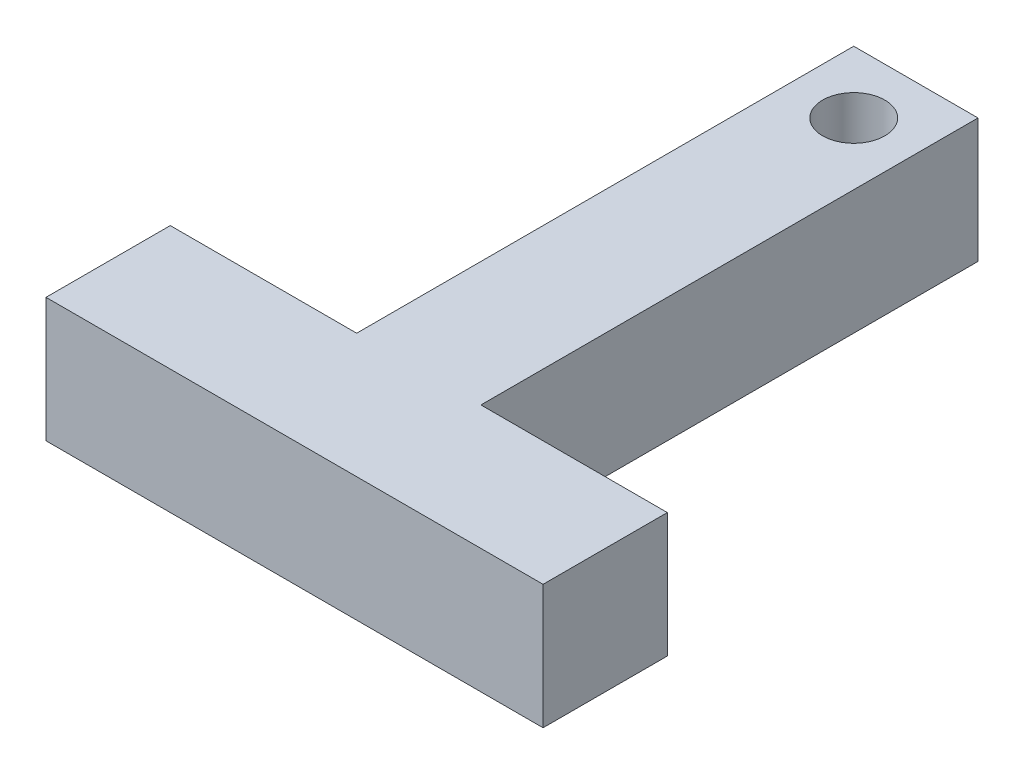
from build123d import *

# Parameters (mm, degrees)
EXTRUDE_1_DEPTH     = 1
SKETCH_2_R          = 0.25
CUT_EXTRUDE_1_DEPTH = 40.833518874


with BuildPart() as part:
    # 草图1 → 凸台-拉伸1 (new body)
    with BuildSketch(Plane(origin=(0, 0, 0), x_dir=(1, 0, 0), z_dir=(0, 1, 0))):
        Polygon((-2, 35.770708139), (-0.5, 35.770708139), (-0.5, 39.770708139), (0.5, 39.770708139), (0.5, 35.770708139), (2, 35.770708139), (2, 34.770708139), (-2, 34.770708139), align=None)
    extrude(amount=EXTRUDE_1_DEPTH)

    # 草图2 → 切除-拉伸1 (cut, through all)
    with BuildSketch(Plane(origin=(0, 1, 0), x_dir=(1, 0, 0), z_dir=(0, 1, 0))):
        with Locations(Location((0, 39.270708139, 0), (0, 0, 270))):
            Circle(SKETCH_2_R)
    extrude(amount=-CUT_EXTRUDE_1_DEPTH, mode=Mode.SUBTRACT)


solid = part.part
